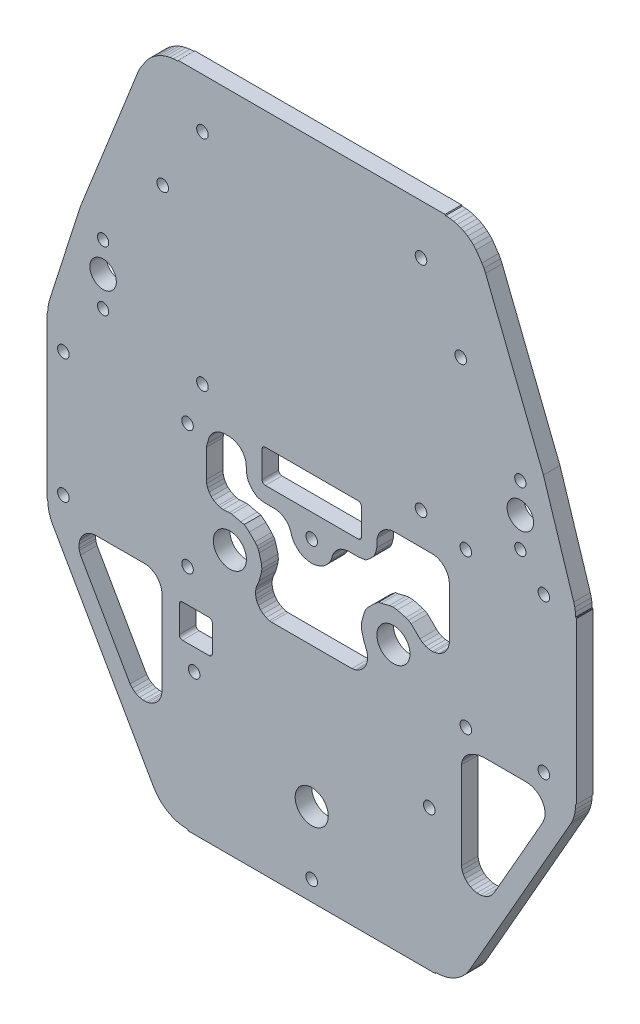
from build123d import *

# Parameters (mm, degrees)
ESQUISSE1_W                                = 200
ESQUISSE1_H                                = 160
ESQUISSE1_R                                = 5
ESQUISSE1_R_2                              = 1.75
ESQUISSE1_W_2                              = 10
ESQUISSE1_H_2                              = 10
ESQUISSE1_H_3                              = 30
BOSS_EXTRU_1_DEPTH                         = 5
CONG_2_R                                   = 1
ENL_V_MAT_EXTRU_1_DEPTH                    = 129.16005618
ESQUISSE3_R                                = 1.75
TROU_CUVE_DIRECTION_DEPTH                  = 129.16005618
ESQUISSE4_R                                = 1.7
ESQUISSE4_R_2                              = 4
ESQUISSE4_R_3                              = 5
POINTE_AVANT_TROUS_BERCEAU_ET_CABLES_DEPTH = 129.16005618
FORME_ARRONDIE_ET_ALLEGEMENT_DEPTH         = 129.16005618


with BuildPart() as part:
    # Esquisse1 → Boss.-Extru.1 (new body)
    with BuildSketch(Plane(origin=(0, 0, 0), x_dir=(0, 1, 0), z_dir=(0, 0, 1))):
        Rectangle(ESQUISSE1_W, ESQUISSE1_H)
        with Locations(Location((-75, 0, 0), (0, 0, 270))):
            Circle(ESQUISSE1_R, mode=Mode.SUBTRACT)
        with Locations(Location((-57.5, 35.5, 0), (0, 0, 270))):
            Circle(ESQUISSE1_R_2, mode=Mode.SUBTRACT)
        with Locations(Location((-57.5, -35.5, 0), (0, 0, 90))):
            Circle(ESQUISSE1_R_2, mode=Mode.SUBTRACT)
        with Locations(Location((65, 45, 0), (0, 0, 270))):
            Circle(ESQUISSE1_R_2, mode=Mode.SUBTRACT)
        with Locations(Location((65, -45, 0), (0, 0, 90))):
            Circle(ESQUISSE1_R_2, mode=Mode.SUBTRACT)
        with Locations(Location((-31, 37.5, 0), (0, 0, 270))):
            Circle(ESQUISSE1_R_2, mode=Mode.SUBTRACT)
        with Locations(Location((-31, 75, 0), (0, 0, 270))):
            Circle(ESQUISSE1_R_2, mode=Mode.SUBTRACT)
        with Locations(Location((6.5, 75, 0), (0, 0, 270))):
            Circle(ESQUISSE1_R_2, mode=Mode.SUBTRACT)
        with Locations(Location((6.5, 37.5, 0), (0, 0, 270))):
            Circle(ESQUISSE1_R_2, mode=Mode.SUBTRACT)
        with Locations(Location((-31, -46.541307377, 0), (0, 0, 270))):
            Circle(ESQUISSE1_R_2, mode=Mode.SUBTRACT)
        with Locations(Location((-31, -70.091307377, 0), (0, 0, 270))):
            Circle(ESQUISSE1_R_2, mode=Mode.SUBTRACT)
        with Locations(Location((15.5, -46.541307377, 0), (0, 0, 270))):
            Circle(ESQUISSE1_R_2, mode=Mode.SUBTRACT)
        with Locations(Location((15.5, -70.091307377, 0), (0, 0, 270))):
            Circle(ESQUISSE1_R_2, mode=Mode.SUBTRACT)
        with Locations(Location((-4.999283545, 0, 0), (0, 0, 270))):
            Circle(ESQUISSE1_R_2, mode=Mode.SUBTRACT)
        with Locations(Location((85, 33, 0), (0, 0, 270))):
            Circle(ESQUISSE1_R_2, mode=Mode.SUBTRACT)
        with Locations(Location((85.001189598, -32.999999989, 0), (0, 0, 270))):
            Circle(ESQUISSE1_R_2, mode=Mode.SUBTRACT)
        with Locations(Location((19, 33, 0), (0, 0, 270))):
            Circle(ESQUISSE1_R_2, mode=Mode.SUBTRACT)
        with Locations(Location((19.001189598, -32.999999989, 0), (0, 0, 270))):
            Circle(ESQUISSE1_R_2, mode=Mode.SUBTRACT)
        with Locations((-46, 35)):
            Rectangle(ESQUISSE1_W_2, ESQUISSE1_H_2, mode=Mode.SUBTRACT)
        with Locations((7, 0)):
            Rectangle(ESQUISSE1_W_2, ESQUISSE1_H_3, mode=Mode.SUBTRACT)
    extrude(amount=BOSS_EXTRU_1_DEPTH)

    # Congé2
    cong_2_edges = [part.edges().sort_by_distance(p)[0] for p in [
        (-40, -51, 2.5),
        (-30, -51, 2.5),
        (-30, -41, 2.5),
        (-40, -41, 2.5),
        (-15, 2, 2.5),
        (15, 2, 2.5),
        (15, 12, 2.5),
        (-15, 12, 2.5),
    ]]
    fillet(cong_2_edges, radius=CONG_2_R)

    # Esquisse2 → Enlèv. mat.-Extru.1 (cut, through all)
    with BuildSketch(Plane.XY.offset(5)):
        Polygon((-573.580399643, 598.167108478), (-698.698151963, -488.082468479), (684.299979338, -647.380682556), (762.904681953, 702.431902078), align=None)
        Polygon((-110, 40), (0, 160), (110, 40), (110, -40), (0, -160), (-110, -40), align=None, mode=Mode.SUBTRACT)
    extrude(amount=-ENL_V_MAT_EXTRU_1_DEPTH, mode=Mode.SUBTRACT)

    # Esquisse3 → Trou cuve direction (cut, through all)
    with BuildSketch(Plane(origin=(0, 0, 0), x_dir=(0, 1, 0), z_dir=(0, 0, 1))):
        with Locations(Location((-94.001515359, 0.004041019, 0), (0, 0, 270))):
            Circle(ESQUISSE3_R)
    extrude(amount=TROU_CUVE_DIRECTION_DEPTH, mode=Mode.SUBTRACT)

    # Esquisse4 → Pointe avant, trous berceau et cables (cut, through all)
    with BuildSketch(Plane.XY.offset(5)):
        with Locations((-63.004041019, 23.738484641)):
            Circle(ESQUISSE4_R)
        with Locations((-63.004041019, 41.738484641)):
            Circle(ESQUISSE4_R)
        with Locations((62.995958981, 23.738484641)):
            Circle(ESQUISSE4_R)
        with Locations((62.995958981, 41.738484641)):
            Circle(ESQUISSE4_R)
        with Locations((-63.004041019, 32.738484641)):
            Circle(ESQUISSE4_R_2)
        with Locations((62.995958981, 32.738484641)):
            Circle(ESQUISSE4_R_2)
        with Locations((-24.724041019, -20.261515359)):
            Circle(ESQUISSE4_R_3)
        with Locations((24.675958981, -20.261515359)):
            Circle(ESQUISSE4_R_3)
        Polygon((-82.024041019, 47.038484641), (-45.024041019, 103.038484641), (-83.024041019, 103.038484641), (-83.024041019, 47.038484641), align=None)
        Polygon((82.015958981, 47.038484641), (45.015958981, 103.038484641), (83.015958981, 103.038484641), (83.015958981, 47.038484641), align=None)
    extrude(amount=-POINTE_AVANT_TROUS_BERCEAU_ET_CABLES_DEPTH, mode=Mode.SUBTRACT)

    # Esquisse5 → Forme arrondie et allegement (cut, through all)
    with BuildSketch(Plane.XY.offset(5)):
        Polygon((-80.324041019, 14.363484641), (-80.254041019, 14.170484641), (-80.076041019, 14.067484641), (-79.874041019, 14.103484641), (-79.742041019, 14.260484641), (-79.662041019, 15.563484641), (-79.477041019, 16.751484641), (-79.170041019, 17.921484641), (-69.975041019, 46.692484641), (-52.443041019, 90.888484641), (-51.938041019, 91.992484641), (-51.322041019, 93.037484641), (-49.680041019, 95.418484641), (-48.909041019, 96.277484641), (-48.056041019, 97.055484641), (-47.132041019, 97.746484641), (-46.143041019, 98.342484641), (-45.101041019, 98.838484641), (-44.015041019, 99.229484641), (-42.896041019, 99.510484641), (-41.754041019, 99.681484641), (-40.499041019, 99.756484641), (-40.358041019, 99.863484641), (-40.302041019, 100.030484641), (-40.349041019, 100.201484641), (-40.485041019, 100.314484641), (-47.056041019, 100.338484641), (-47.288041019, 100.227484641), (-80.302041019, 50.254484641), align=None)
        Polygon((-80.324041019, -72.688515359), (-80.245041019, -72.891515359), (-55.173041019, -100.222515359), (-37.575041019, -100.261515359), (-37.328041019, -100.131515359), (-37.286041019, -99.882515359), (-37.476041019, -99.678515359), (-39.799041019, -99.447515359), (-40.886041019, -99.182515359), (-41.942041019, -98.815515359), (-42.959041019, -98.348515359), (-43.926041019, -97.787515359), (-44.835041019, -97.136515359), (-45.678041019, -96.401515359), (-46.447041019, -95.588515359), (-47.135041019, -94.706515359), (-47.739041019, -93.757515359), (-78.180041019, -40.448515359), (-78.730041019, -39.358515359), (-79.161041019, -38.223515359), (-79.473041019, -37.050515359), (-79.661041019, -35.852515359), (-79.733041019, -34.565515359), (-79.849041019, -34.396515359), (-80.017041019, -34.340515359), (-80.234041019, -34.425515359), (-80.324041019, -34.640515359), align=None)
        Polygon((54.975958981, -100.261515359), (55.196958981, -100.164515359), (80.255958981, -72.797515359), (80.275958981, -34.710515359), (80.223958981, -34.541515359), (80.085958981, -34.430515359), (79.852958981, -34.436515359), (79.693958981, -34.607515359), (79.612958981, -35.922515359), (79.424958981, -37.120515359), (79.112958981, -38.293515359), (78.681958981, -39.428515359), (78.131958981, -40.518515359), (47.730958981, -93.757515359), (47.126958981, -94.706515359), (46.438958981, -95.588515359), (45.669958981, -96.401515359), (44.826958981, -97.136515359), (43.917958981, -97.787515359), (42.950958981, -98.348515359), (41.933958981, -98.815515359), (40.877958981, -99.182515359), (39.790958981, -99.447515359), (38.684958981, -99.607515359), (37.495958981, -99.670515359), (37.328958981, -99.779515359), (37.266958981, -99.968515359), (37.357958981, -100.176515359), (37.566958981, -100.261515359), align=None)
        Polygon((80.275958981, 50.128484641), (47.231958981, 100.227484641), (46.999958981, 100.338484641), (40.544958981, 100.338484641), (40.352958981, 100.268484641), (40.247958981, 100.001484641), (40.442958981, 99.756484641), (41.697958981, 99.681484641), (42.839958981, 99.510484641), (43.958958981, 99.229484641), (45.044958981, 98.838484641), (46.086958981, 98.342484641), (47.075958981, 97.746484641), (47.999958981, 97.055484641), (48.851958981, 96.277484641), (49.623958981, 95.418484641), (51.385958981, 92.855484641), (52.001958981, 91.809484641), (52.506958981, 90.706484641), (69.966958981, 46.692484641), (79.121958981, 18.047484641), (79.428958981, 16.877484641), (79.613958981, 15.689484641), (79.684958981, 14.414484641), (79.800958981, 14.244484641), (79.968958981, 14.188484641), (80.185958981, 14.273484641), (80.275958981, 14.488484641), align=None)
        Polygon((-12.185041019, -32.836515359), (12.118958981, -32.833515359), (13.123958981, -32.630515359), (13.648958981, -32.439515359), (14.548958981, -31.948515359), (14.993958981, -31.611515359), (15.709958981, -30.877515359), (16.035958981, -30.424515359), (16.503958981, -29.511515359), (16.797958981, -28.467515359), (16.874958981, -27.444515359), (16.832958981, -26.887515359), (16.594958981, -25.859515359), (15.798958981, -23.990515359), (15.100958981, -21.386515359), (14.958958981, -20.345515359), (15.035958981, -19.367515359), (15.895958981, -16.155515359), (16.452958981, -15.063515359), (17.046958981, -14.350515359), (18.778958981, -12.618515359), (20.267958981, -11.381515359), (20.982958981, -11.315515359), (23.487958981, -10.672515359), (24.528958981, -10.529515359), (25.815958981, -10.672515359), (28.418958981, -11.370515359), (29.172958981, -11.655515359), (30.009958981, -12.168515359), (32.686958981, -14.788515359), (33.498958981, -15.403515359), (34.441958981, -15.861515359), (35.427958981, -16.120515359), (36.416958981, -16.186515359), (36.954958981, -16.145515359), (38.397958981, -15.745515359), (38.880958981, -15.504515359), (39.693958981, -14.939515359), (40.087958981, -14.570515359), (40.706958981, -13.796515359), (41.191958981, -12.867515359), (41.474958981, -11.918515359), (41.551958981, -11.384515359), (41.575958981, 4.053484641), (41.470958981, 5.086484641), (41.166958981, 6.080484641), (40.673958981, 6.995484641), (40.012958981, 7.796484641), (39.207958981, 8.453484641), (38.317958981, 8.929484641), (37.323958981, 9.233484641), (36.780958981, 9.314484641), (24.960958981, 9.338484641), (23.927958981, 9.233484641), (22.490958981, 8.719484641), (22.018958981, 8.436484641), (21.217958981, 7.775484641), (20.577958981, 6.995484641), (20.294958981, 6.523484641), (19.908958981, 5.590484641), (19.774958981, 5.057484641), (19.643958981, 2.527484641), (19.266958981, 0.971484641), (18.967958981, 0.298484641), (18.566958981, -0.319515359), (17.524958981, -1.397515359), (16.363958981, -2.335515359), (14.282958981, -2.647515359), (10.726958981, -2.690515359), (9.683958981, -2.906515359), (8.704958981, -3.326515359), (7.829958981, -3.934515359), (7.111958981, -4.681515359), (6.803958981, -5.116515359), (6.324958981, -6.068515359), (5.916958981, -7.402515359), (5.616958981, -8.075515359), (5.060958981, -8.884515359), (4.133958981, -9.835515359), (3.303958981, -10.479515359), (2.417958981, -10.901515359), (0.831958981, -11.326515359), (-0.147041019, -11.403515359), (-1.188041019, -11.261515359), (-2.696041019, -10.813515359), (-3.558041019, -10.345515359), (-4.182041019, -9.835515359), (-5.109041019, -8.884515359), (-5.665041019, -8.075515359), (-5.965041019, -7.402515359), (-6.373041019, -6.068515359), (-6.852041019, -5.116515359), (-7.490041019, -4.301515359), (-7.878041019, -3.934515359), (-8.753041019, -3.326515359), (-9.732041019, -2.906515359), (-10.775041019, -2.690515359), (-14.331041019, -2.647515359), (-16.415041019, -2.318515359), (-17.807041019, -1.186515359), (-18.759041019, -0.120515359), (-19.127041019, 0.517484641), (-19.413041019, 1.271484641), (-19.692041019, 2.527484641), (-19.823041019, 5.057484641), (-20.133041019, 6.080484641), (-20.609041019, 6.970484641), (-20.937041019, 7.411484641), (-21.651041019, 8.125484641), (-22.092041019, 8.453484641), (-23.010041019, 8.940484641), (-24.005041019, 9.239484641), (-25.009041019, 9.338484641), (-26.584041019, 9.315484641), (-27.576041019, 9.126484641), (-28.080041019, 8.951484641), (-28.975041019, 8.486484641), (-29.766041019, 7.859484641), (-30.424041019, 7.093484641), (-30.925041019, 6.217484641), (-31.569041019, 4.137484641), (-31.793041019, 3.084484641), (-31.824041019, -5.400515359), (-31.724041019, -6.411515359), (-31.443041019, -7.358515359), (-30.977041019, -8.260515359), (-30.326041019, -9.078515359), (-29.552041019, -9.736515359), (-28.219041019, -10.407515359), (-27.702041019, -10.553515359), (-26.723041019, -10.682515359), (-24.871041019, -10.529515359), (-24.135041019, -10.568515359), (-21.474041019, -11.234515359), (-20.357041019, -11.401515359), (-18.876041019, -12.618515359), (-17.144041019, -14.350515359), (-16.549041019, -15.063515359), (-16.180041019, -15.701515359), (-15.860041019, -16.573515359), (-15.197041019, -19.059515359), (-15.055041019, -20.345515359), (-15.197041019, -21.386515359), (-15.860041019, -23.872515359), (-16.691041019, -25.859515359), (-16.836041019, -26.367515359), (-16.933041019, -26.917515359), (-16.958041019, -27.942515359), (-16.778041019, -28.982515359), (-16.600041019, -29.511515359), (-16.116041019, -30.449515359), (-15.456041019, -31.272515359), (-14.645041019, -31.948515359), (-13.745041019, -32.439515359), (-12.737041019, -32.753515359), align=None)
        Polygon((48.837958981, -36.941515359), (47.476958981, -37.612515359), (47.046958981, -37.941515359), (46.352958981, -38.652515359), (46.034958981, -39.090515359), (45.572958981, -39.970515359), (45.392958981, -40.480515359), (45.201958981, -41.456515359), (45.199958981, -67.872515359), (45.395958981, -68.881515359), (45.781958981, -69.833515359), (46.345958981, -70.693515359), (47.064958981, -71.428515359), (47.911958981, -72.010515359), (48.855958981, -72.418515359), (49.859958981, -72.636515359), (50.887958981, -72.656515359), (51.927958981, -72.469515359), (53.306958981, -71.852515359), (54.139958981, -71.202515359), (55.070958981, -70.013515359), (69.786958981, -44.243515359), (70.340958981, -42.819515359), (70.436958981, -42.278515359), (70.463958981, -41.267515359), (70.291958981, -40.242515359), (70.120958981, -39.719515359), (69.652958981, -38.790515359), (69.032958981, -37.992515359), (68.634958981, -37.612515359), (67.783958981, -37.014515359), (66.750958981, -36.528515359), (65.819958981, -36.258515359), (64.813958981, -36.161515359), (51.756958981, -36.161515359), (50.305958981, -36.368515359), align=None)
        Polygon((-50.524041019, -36.661515359), (-65.536041019, -36.689515359), (-66.539041019, -36.891515359), (-67.537041019, -37.311515359), (-68.383041019, -37.886515359), (-68.771041019, -38.243515359), (-69.448041019, -39.088515359), (-69.917041019, -39.998515359), (-70.088041019, -40.496515359), (-70.279041019, -41.562515359), (-70.258041019, -42.585515359), (-70.170041019, -43.105515359), (-69.829041019, -44.132515359), (-54.841041019, -70.376515359), (-54.188041019, -71.131515359), (-53.379041019, -71.767515359), (-52.907041019, -72.036515359), (-51.948041019, -72.407515359), (-50.936041019, -72.586515359), (-49.937041019, -72.569515359), (-49.401041019, -72.481515359), (-48.422041019, -72.167515359), (-47.135041019, -71.377515359), (-46.735041019, -71.008515359), (-46.107041019, -70.231515359), (-45.614041019, -69.296515359), (-45.327041019, -68.340515359), (-45.248041019, -67.802515359), (-45.224041019, -41.961515359), (-45.329041019, -40.913515359), (-45.633041019, -39.919515359), (-46.418041019, -38.610515359), (-47.173041019, -37.855515359), (-48.482041019, -37.070515359), (-49.505041019, -36.760515359), align=None)
    extrude(amount=-FORME_ARRONDIE_ET_ALLEGEMENT_DEPTH, mode=Mode.SUBTRACT)


solid = part.part
